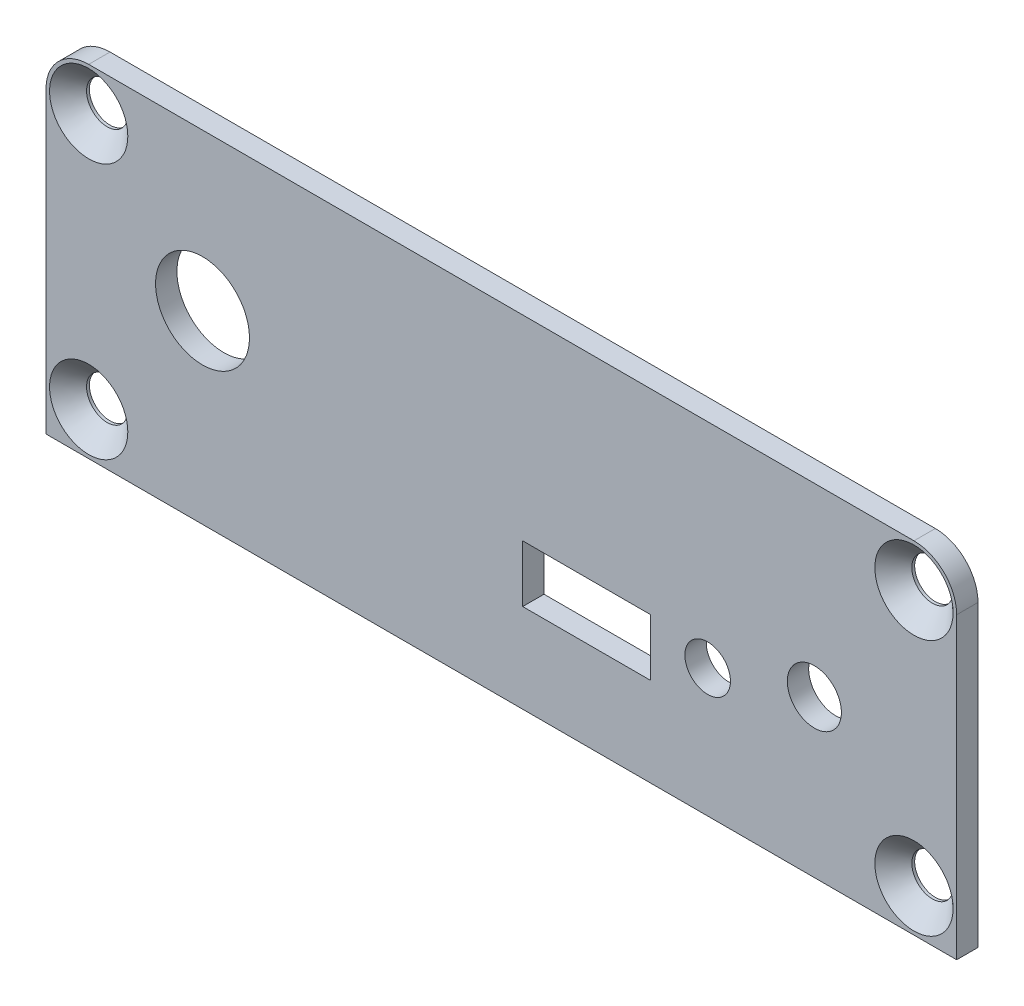
from build123d import *

# Parameters (mm, degrees)
SKETCH1_W                                      = 64
SKETCH1_H                                      = 24
BOSS_EXTRUDE1_DEPTH                            = 1.5
CSK_FOR_M2_5_FLAT_HEAD_MACHINE_SCREW1_AT_COUNT = 2
CSK_FOR_M2_5_FLAT_HEAD_MACHINE_SCREW1_AT_PITCH = 58
CSK_FOR_M2_5_FLAT_HEAD_MACHINE_SCREW_2_COUNT   = 2
CSK_FOR_M2_5_FLAT_HEAD_MACHINE_SCREW_2_PITCH   = 18
CSK_FOR_M2_5_FLAT_HEAD_MACHINE_SCREW_3_COUNT   = 2
CSK_FOR_M2_5_FLAT_HEAD_MACHINE_SCREW_3_PITCH   = 60.728905803
FILLET1_R                                      = 3
SKETCH4_R                                      = 3.3
CUT_EXTRUDE1_DEPTH                             = 35.208916966
SKETCH5_R                                      = 1.6
CUT_EXTRUDE2_DEPTH                             = 35.208916966
SKETCH6_R                                      = 1.9
CUT_EXTRUDE3_DEPTH                             = 35.208916966
SKETCH7_W                                      = 9
SKETCH7_H                                      = 4
CUT_EXTRUDE4_DEPTH                             = 35.208916966


with BuildPart() as part:
    # Sketch1 → Boss-Extrude1 (new body)
    with BuildSketch(Plane.XY):
        Rectangle(SKETCH1_W, SKETCH1_H)
    extrude(amount=-BOSS_EXTRUDE1_DEPTH)

    # Sketch2 → CSK for M2.5 Flat Head Machine Screw1 (revolve, cut)
    with BuildSketch(Plane(origin=(-29, 9, 0), x_dir=(0, -1, 0), z_dir=(1, 0, 0))):
        Polygon((0, 0), (0, 1.5), (1.45, 1.5), (1.45, 1.3), (2.75, 0), align=None)
    csk_for_m2_5_flat_head_machine_screw1 = revolve(axis=Axis((-29, 9, 6.35), (0, 0, -1)), mode=Mode.SUBTRACT)

    # CSK for M2.5 Flat Head Machine Screw1 at: CSK for M2.5 Flat Head Machine Screw1 ×2
    with Locations(*[(i * CSK_FOR_M2_5_FLAT_HEAD_MACHINE_SCREW1_AT_PITCH, 0, 0) for i in range(1, CSK_FOR_M2_5_FLAT_HEAD_MACHINE_SCREW1_AT_COUNT)]):
        add(csk_for_m2_5_flat_head_machine_screw1, mode=Mode.SUBTRACT)

    # CSK for M2.5 Flat Head Machine Screw 2: CSK for M2.5 Flat Head Machine Screw1 ×2
    with Locations(*[(0, -i * CSK_FOR_M2_5_FLAT_HEAD_MACHINE_SCREW_2_PITCH, 0) for i in range(1, CSK_FOR_M2_5_FLAT_HEAD_MACHINE_SCREW_2_COUNT)]):
        add(csk_for_m2_5_flat_head_machine_screw1, mode=Mode.SUBTRACT)

    # CSK for M2.5 Flat Head Machine Screw 3: CSK for M2.5 Flat Head Machine Screw1 ×2
    with Locations(*[Vector(0.9550641368112371, -0.2963992148724529, 0) * (i * CSK_FOR_M2_5_FLAT_HEAD_MACHINE_SCREW_3_PITCH) for i in range(1, CSK_FOR_M2_5_FLAT_HEAD_MACHINE_SCREW_3_COUNT)]):
        add(csk_for_m2_5_flat_head_machine_screw1, mode=Mode.SUBTRACT)

    # Fillet1
    fillet1_edges = [part.edges().sort_by_distance(p)[0] for p in [
        (-32, 12, -0.75),
        (32, 12, -0.75),
    ]]
    fillet(fillet1_edges, radius=FILLET1_R)

    # Sketch4 → Cut-Extrude1 (cut, through all)
    with BuildSketch(Plane.XY):
        with Locations((-21, 1)):
            Circle(SKETCH4_R)
    extrude(amount=-CUT_EXTRUDE1_DEPTH, mode=Mode.SUBTRACT)

    # Sketch5 → Cut-Extrude2 (cut, through all)
    with BuildSketch(Plane.XY):
        with Locations((14.5, -3)):
            Circle(SKETCH5_R)
    extrude(amount=-CUT_EXTRUDE2_DEPTH, mode=Mode.SUBTRACT)

    # Sketch6 → Cut-Extrude3 (cut, through all)
    with BuildSketch(Plane.XY):
        with Locations((22, -1)):
            Circle(SKETCH6_R)
    extrude(amount=-CUT_EXTRUDE3_DEPTH, mode=Mode.SUBTRACT)

    # Sketch7 → Cut-Extrude4 (cut, through all)
    with BuildSketch(Plane.XY):
        with Locations((6, -3.75)):
            Rectangle(SKETCH7_W, SKETCH7_H)
    extrude(amount=-CUT_EXTRUDE4_DEPTH, mode=Mode.SUBTRACT)


solid = part.part
